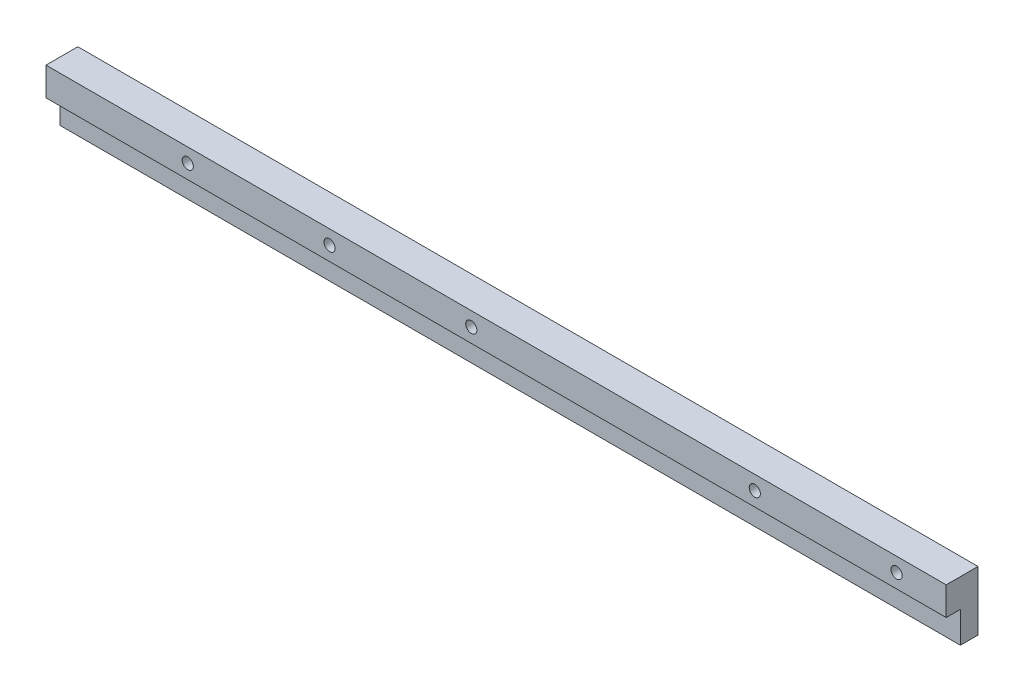
from build123d import *
from build123d.topology import SkipClean

# Parameters (mm, degrees)
BOSS_EXTRUDE1_DEPTH     = 177.8
SKETCH2_R               = 6.35
BOSS_EXTRUDE2_DEPTH     = 3.175
CUT_EXTRUDE1_DEPTH      = 7.62
SKETCH4_R               = 35.56
CUT_EXTRUDE2_DEPTH      = 5.08
BOSS_EXTRUDE3_DEPTH     = 3.175
BOSS_EXTRUDE4_START     = -3.175
BOSS_EXTRUDE4_DEPTH     = 3.175
SKETCH2_3_R             = 6.35
CUT_EXTRUDE3_DEPTH      = 203.2
SKETCH7_W               = 104.303861479
SKETCH7_H               = 17.78
CUT_EXTRUDE4_DEPTH      = 7.62
SKETCH9_W               = 5.09491902
SKETCH9_H               = 10.16
BOSS_EXTRUDE5_DEPTH     = 373.38
SKETCH10_W              = 16.389929124
SKETCH10_H              = 55.852942909
CUT_EXTRUDE5_DEPTH      = 50.8
SKETCH11_W              = 37.311204657
SKETCH11_H              = 70.036499624
CUT_EXTRUDE6_DEPTH      = 63.5
CUT_EXTRUDE_THIN3_DEPTH = 1.27
BOSS_EXTRUDE6_DEPTH     = 1.27
BOSS_EXTRUDE6_2_DEPTH   = 1.27
BOSS_EXTRUDE6_3_DEPTH   = 1.27
BOSS_EXTRUDE6_4_DEPTH   = 1.27
SKETCH14_R              = 6.35
CUT_EXTRUDE7_DEPTH      = 6.35
SKETCH15_R              = 6.35
CUT_EXTRUDE8_DEPTH      = 6.35
SKETCH16_R              = 2
CUT_EXTRUDE9_DEPTH      = 203.2
SKETCH17_R              = 2
CUT_EXTRUDE10_DEPTH     = 50.8
CUT_EXTRUDE11_DEPTH     = 50.8
CUT_EXTRUDE12_DEPTH     = 135.636
SKETCH20_W              = 88.9
SKETCH20_H              = 19.05
CUT_EXTRUDE13_DEPTH     = 25.4
SKETCH22_W              = 88.9
SKETCH22_H              = 19.05
CUT_EXTRUDE14_DEPTH     = 25.4
CUT_EXTRUDE15_DEPTH     = 12.7
SKETCH24_R              = 1.5
CUT_EXTRUDE16_DEPTH     = 12.7
SKETCH25_W              = 227.828611999
SKETCH25_H              = 364.913546761
CUT_EXTRUDE17_DEPTH     = 381


with BuildPart() as part:
    # Sketch1 → Boss-Extrude1 (new body)
    with BuildSketch(Plane.XY):
        Polygon((174.206706958, 205.225588808), (176.700980282, 203.057350086), (6.59291173, 7.37040221), (4.098638405, 9.538640932), align=None)
        Polygon((176.700980282, 203.057350086), (176.700980282, 207.584488047), (174.206706958, 205.225588808), align=None)
        Polygon((176.700980282, 203.057350086), (176.700980282, 207.584488047), (294.86623267, 79.97762329), (292.609334988, 77.887713122), align=None)
        Polygon((176.700980282, 203.057350086), (6.59291173, 7.37040221), (11.706315855, 7.37040221), (176.700980282, 197.43083223), align=None)
        Polygon((292.609334988, 77.887713122), (179.222024463, 200.334870023), (176.700980282, 197.43083223), (289.802992908, 75.306026972), align=None)
        Polygon((179.222024463, 200.334870023), (176.700980282, 203.057350086), (176.700980282, 197.43083223), align=None)
    extrude(amount=BOSS_EXTRUDE1_DEPTH)

    # Sketch2 → Boss-Extrude2 (add)
    with BuildSketch(Plane(origin=(0, 0, 0), x_dir=(-1, 0, 0), z_dir=(0, 0, -1))):
        Polygon((-176.700980282, 207.584488047), (-294.86623267, 79.97762329), (-294.86623267, 308.57762329), (-4.03623267, 308.57762329), (-4.03623267, 9.466851346), align=None)
        with Locations((-109.551832016, 215.6073789)):
            Circle(SKETCH2_R, mode=Mode.SUBTRACT)
        with Locations((-50.099162461, 143.63835786)):
            Circle(SKETCH2_R, mode=Mode.SUBTRACT)
    boss_extrude2 = extrude(amount=-BOSS_EXTRUDE2_DEPTH)

    # Mirror1: Boss-Extrude2 across plane
    add(boss_extrude2.mirror(Plane.XY.offset(88.9)))

    # Sketch3 → Cut-Extrude1 (cut)
    with BuildSketch(Plane(origin=(-2.388376456, 2.076183978, 0), x_dir=(0.6560590289905027, 0.754709580222776, 0), z_dir=(-0.754709580222776, 0.6560590289905027, 0))):
        Polygon((146.938003774, -3.175), (147.021985505, -88.9), (210.43489334, -88.9), (210.43489334, -3.175), align=None)
        Polygon((210.43489334, -88.9), (147.021985505, -88.9), (147.047852426, -115.303859178), (210.43489334, -115.303859178), align=None)
    extrude(amount=-CUT_EXTRUDE1_DEPTH, mode=Mode.SUBTRACT)

    # Sketch4 → Cut-Extrude2 (cut)
    with BuildSketch(Plane.XY.offset(3.175)):
        with Locations((115.138547862, 136.94700246)):
            Circle(SKETCH4_R)
    extrude(amount=-CUT_EXTRUDE2_DEPTH, mode=Mode.SUBTRACT)

    # Sketch5 → Boss-Extrude3 (add)
    with BuildSketch(Plane(origin=(0, 0, 0), x_dir=(-1, 0, 0), z_dir=(0, 0, -1))):
        with BuildLine():
            Line((23.718677813, 87.809342908), (-4.03623267, 87.809342908))
            Line((-4.03623267, 87.809342908), (-4.03623267, 68.97229904))
            ThreePointArc((-4.03623267, 68.97229904), (2.710389506, 69.812621892), (6.35, 64.070123417))
            ThreePointArc((6.35, 64.070123417), (2.710389506, 58.327624943), (-4.03623267, 59.167947795))
            Line((-4.03623267, 59.167947795), (-4.03623267, 41.258157594))
            Line((-4.03623267, 41.258157594), (23.718677813, 41.258157594))
            Line((23.718677813, 41.258157594), (23.718677813, 87.809342908))
        make_face()
    extrude(amount=-BOSS_EXTRUDE3_DEPTH)

    # Sketch6 → Boss-Extrude4 (add)
    with BuildSketch(Plane.XY.offset(177.8).offset(BOSS_EXTRUDE4_START)):
        with BuildLine():
            Line((4.03623267, 68.97229904), (4.03623267, 87.809342908))
            Line((4.03623267, 87.809342908), (-23.718677813, 87.809342908))
            Line((-23.718677813, 87.809342908), (-23.718677813, 41.258157594))
            Line((-23.718677813, 41.258157594), (4.03623267, 41.258157594))
            Line((4.03623267, 41.258157594), (4.03623267, 59.167947795))
            ThreePointArc((4.03623267, 59.167947795), (-6.35, 64.070123417), (4.03623267, 68.97229904))
        make_face()
    extrude(amount=BOSS_EXTRUDE4_DEPTH)

    # Sketch2<3> → Cut-Extrude3 (cut)
    with SkipClean():  # the faces are left unmerged after this step: merging them gives an invalid solid
        with BuildSketch(Plane(origin=(0, 0, 0), x_dir=(-1, 0, 0), z_dir=(0, 0, -1))):
            with Locations((0, 64.070123417)):
                Circle(SKETCH2_3_R)
        extrude(amount=-CUT_EXTRUDE3_DEPTH, mode=Mode.SUBTRACT)

    # Sketch7 → Cut-Extrude4 (cut)
    with SkipClean():  # the faces are left unmerged after this step: merging them gives an invalid solid
        with BuildSketch(Plane(origin=(198.614996443, 183.919503291, 0), x_dir=(0, 0, -1), z_dir=(0.7337298645028701, 0.6794413042615234, 0))):
            with Locations((-88.799310538, -132.772327008)):
                Rectangle(SKETCH7_W, SKETCH7_H)
        extrude(amount=-CUT_EXTRUDE4_DEPTH, mode=Mode.SUBTRACT)

    # Sketch9 → Boss-Extrude5 (add)
    with SkipClean():  # the faces are left unmerged after this step: merging them gives an invalid solid
        with BuildSketch(Plane(origin=(294.86623267, 0, 0), x_dir=(0, 0, -1), z_dir=(1, 0, 0))):
            with Locations((2.54745951, 191.791667894)):
                Rectangle(SKETCH9_W, SKETCH9_H)
            Polygon((5.09491902, 196.871667894), (5.09491902, 186.711667894), (5.09491902, 175.560674011), (11.405822058, 175.560674011), (11.405822058, 196.871667894), align=None)
        boss_extrude5 = extrude(amount=-BOSS_EXTRUDE5_DEPTH)

    # Mirror2: Boss-Extrude5 across plane
    with SkipClean():  # the faces are left unmerged after this step: merging them gives an invalid solid
        add(boss_extrude5.mirror(Plane.XY.offset(88.9)))

    # Sketch10 → Cut-Extrude5 (cut)
    with SkipClean():  # the faces are left unmerged after this step: merging them gives an invalid solid
        with BuildSketch(Plane(origin=(294.86623267, 0, 0), x_dir=(0, 0, -1), z_dir=(1, 0, 0))):
            with Locations((8.194964562, 177.809205996)):
                Rectangle(SKETCH10_W, SKETCH10_H)
        extrude(amount=-CUT_EXTRUDE5_DEPTH, mode=Mode.SUBTRACT)

    # Sketch11 → Cut-Extrude6 (cut)
    with SkipClean():  # the faces are left unmerged after this step: merging them gives an invalid solid
        with BuildSketch(Plane(origin=(0, 0, 0), x_dir=(-1, 0, 0), z_dir=(0, 0, -1))):
            with Locations((-276.210630342, 174.143668429)):
                Rectangle(SKETCH11_W, SKETCH11_H)
        extrude(amount=-CUT_EXTRUDE6_DEPTH, mode=Mode.SUBTRACT)

    # Sketch12 → Cut-Extrude-Thin3 (cut)
    with SkipClean():  # the faces are left unmerged after this step: merging them gives an invalid solid
        with BuildSketch(Plane(origin=(198.614996443, 183.919503291, 0), x_dir=(0, 0, -1), z_dir=(0.7337298645028701, 0.6794413042615234, 0))):
            Polygon((-171.532951818, 28.022585612), (-143.20199229, -115.162103868), (-139.962790584, -114.521185535), (-168.293750113, 28.663503944), align=None)
            Polygon((-33.454545449, -115.162103868), (-6.228065693, 28.022585612), (-9.471942339, 28.639406741), (-36.698422095, -114.545282739), align=None)
        extrude(amount=-CUT_EXTRUDE_THIN3_DEPTH, mode=Mode.SUBTRACT)

    # Sketch14 → Cut-Extrude7 (cut)
    with SkipClean():  # the faces are left unmerged after this step: merging them gives an invalid solid
        with BuildSketch(Plane.XY.offset(3.175)):
            with Locations((25.62623267, 167.726388192)):
                Circle(SKETCH14_R)
        extrude(amount=-CUT_EXTRUDE7_DEPTH, mode=Mode.SUBTRACT)

    # Sketch15 → Cut-Extrude8 (cut)
    with SkipClean():  # the faces are left unmerged after this step: merging them gives an invalid solid
        with BuildSketch(Plane.XY.offset(177.8)):
            with Locations((25.62623267, 167.726388192)):
                Circle(SKETCH15_R)
        extrude(amount=-CUT_EXTRUDE8_DEPTH, mode=Mode.SUBTRACT)

    # Sketch16 → Cut-Extrude9 (cut)
    with SkipClean():  # the faces are left unmerged after this step: merging them gives an invalid solid
        with BuildSketch(Plane(origin=(0, 0, -11.405822058), x_dir=(-1, 0, 0), z_dir=(0, 0, -1))):
            with Locations(Location((-226.28623267, 191.791667894, 0), (0, 0, 180))):
                Circle(SKETCH16_R)
            with Locations(Location((-175.48623267, 191.791667894, 0), (0, 0, 90))):
                Circle(SKETCH16_R)
            with Locations(Location((-73.88623267, 191.791667894, 0), (0, 0, 180))):
                Circle(SKETCH16_R)
            with Locations(Location((-23.08623267, 191.791667894, 0), (0, 0, 180))):
                Circle(SKETCH16_R)
            with Locations(Location((27.71376733, 191.791667894, 0), (0, 0, 90))):
                Circle(SKETCH16_R)
        extrude(amount=-CUT_EXTRUDE9_DEPTH, mode=Mode.SUBTRACT)

    # Sketch17 → Cut-Extrude10 (cut)
    with SkipClean():  # the faces are left unmerged after this step: merging them gives an invalid solid
        with BuildSketch(Plane.XY.offset(189.205822058)):
            with Locations((272.00623267, 191.73762329)):
                Circle(SKETCH17_R)
        extrude(amount=-CUT_EXTRUDE10_DEPTH, mode=Mode.SUBTRACT)

    # Sketch18 → Cut-Extrude11 (cut)
    with SkipClean():  # the faces are left unmerged after this step: merging them gives an invalid solid
        with BuildSketch(Plane(origin=(198.614996443, 183.919503291, 0), x_dir=(0, 0, -1), z_dir=(0.7337298645028701, 0.6794413042615234, 0))):
            Polygon((-170.82495725, -33.509501551), (-170.82495725, -115.912858784), (-148.021512482, -115.912858784), (-165.124096058, -33.509501551), align=None)
        extrude(amount=-CUT_EXTRUDE11_DEPTH, mode=Mode.SUBTRACT)

    # Sketch19 → Cut-Extrude12 (cut)
    with SkipClean():  # the faces are left unmerged after this step: merging them gives an invalid solid
        with BuildSketch(Plane(origin=(198.614996443, 183.919503291, 0), x_dir=(0, 0, -1), z_dir=(0.7337298645028701, 0.6794413042615234, 0))):
            Polygon((-27.790980507, -115.912858784), (-12.83560064, -35.35545082), (-7.206169917, -35.35545082), (-7.206169917, -115.912858784), align=None)
        extrude(amount=-CUT_EXTRUDE12_DEPTH, mode=Mode.SUBTRACT)

    # Sketch20 → Cut-Extrude13 (cut)
    with SkipClean():  # the faces are left unmerged after this step: merging them gives an invalid solid
        with BuildSketch(Plane.XY.offset(177.8)):
            with BuildLine():
                Line((162.857920191, 291.02562329), (162.857920191, 292.57562329))
                Line((162.857920191, 292.57562329), (164.407920191, 292.57562329))
                ThreePointArc((164.407920191, 292.57562329), (161.76190468, 293.671638801), (162.857920191, 291.02562329))
            make_face()
            with BuildLine():
                Line((164.407920191, 292.57562329), (162.857920191, 292.57562329))
                Line((162.857920191, 292.57562329), (162.857920191, 291.02562329))
                ThreePointArc((162.857920191, 291.02562329), (163.953935702, 291.479607779), (164.407920191, 292.57562329))
            make_face()
            with BuildLine():
                ThreePointArc((266.007920191, 292.57562329), (264.457920191, 294.12562329), (262.907920191, 292.57562329))
                Line((262.907920191, 292.57562329), (264.457920191, 292.57562329))
                Line((264.457920191, 292.57562329), (264.457920191, 291.02562329))
                ThreePointArc((264.457920191, 291.02562329), (265.553935702, 291.479607779), (266.007920191, 292.57562329))
            make_face()
            with BuildLine():
                Line((264.457920191, 292.57562329), (262.907920191, 292.57562329))
                ThreePointArc((262.907920191, 292.57562329), (263.36190468, 291.479607779), (264.457920191, 291.02562329))
                Line((264.457920191, 291.02562329), (264.457920191, 292.57562329))
            make_face()
            with BuildLine():
                ThreePointArc((164.407920191, 241.77562329), (163.953935702, 242.871638801), (162.857920191, 243.32562329))
                Line((162.857920191, 243.32562329), (162.857920191, 241.77562329))
                Line((162.857920191, 241.77562329), (164.407920191, 241.77562329))
            make_face()
            with BuildLine():
                Line((162.857920191, 241.77562329), (162.857920191, 243.32562329))
                ThreePointArc((162.857920191, 243.32562329), (161.76190468, 240.679607779), (164.407920191, 241.77562329))
                Line((164.407920191, 241.77562329), (162.857920191, 241.77562329))
            make_face()
            with BuildLine():
                ThreePointArc((266.007920191, 241.77562329), (265.553935702, 242.871638801), (264.457920191, 243.32562329))
                Line((264.457920191, 243.32562329), (264.457920191, 241.77562329))
                Line((264.457920191, 241.77562329), (262.907920191, 241.77562329))
                ThreePointArc((262.907920191, 241.77562329), (264.457920191, 240.22562329), (266.007920191, 241.77562329))
            make_face()
            with BuildLine():
                Line((264.457920191, 241.77562329), (264.457920191, 243.32562329))
                ThreePointArc((264.457920191, 243.32562329), (263.36190468, 242.871638801), (262.907920191, 241.77562329))
                Line((262.907920191, 241.77562329), (264.457920191, 241.77562329))
            make_face()
            with Locations((213.657920191, 282.969686208)):
                Rectangle(SKETCH20_W, SKETCH20_H)
        extrude(amount=-CUT_EXTRUDE13_DEPTH, mode=Mode.SUBTRACT)

    # Sketch22 → Cut-Extrude14 (cut)
    with SkipClean():  # the faces are left unmerged after this step: merging them gives an invalid solid
        with BuildSketch(Plane(origin=(0, 0, 0), x_dir=(-1, 0, 0), z_dir=(0, 0, -1))):
            with BuildLine():
                Line((-264.581570713, 291.02562329), (-264.581570713, 292.57562329))
                Line((-264.581570713, 292.57562329), (-263.031570713, 292.57562329))
                ThreePointArc((-263.031570713, 292.57562329), (-265.677586224, 293.671638801), (-264.581570713, 291.02562329))
            make_face()
            with BuildLine():
                Line((-263.031570713, 292.57562329), (-264.581570713, 292.57562329))
                Line((-264.581570713, 292.57562329), (-264.581570713, 291.02562329))
                ThreePointArc((-264.581570713, 291.02562329), (-263.485555202, 291.479607779), (-263.031570713, 292.57562329))
            make_face()
            with BuildLine():
                ThreePointArc((-263.031570713, 241.77562329), (-263.485555202, 242.871638801), (-264.581570713, 243.32562329))
                Line((-264.581570713, 243.32562329), (-264.581570713, 241.77562329))
                Line((-264.581570713, 241.77562329), (-263.031570713, 241.77562329))
            make_face()
            with BuildLine():
                Line((-264.581570713, 241.77562329), (-264.581570713, 243.32562329))
                ThreePointArc((-264.581570713, 243.32562329), (-265.677586224, 240.679607779), (-263.031570713, 241.77562329))
                Line((-263.031570713, 241.77562329), (-264.581570713, 241.77562329))
            make_face()
            with BuildLine():
                ThreePointArc((-161.431570713, 292.57562329), (-162.981570713, 294.12562329), (-164.531570713, 292.57562329))
                Line((-164.531570713, 292.57562329), (-162.981570713, 292.57562329))
                Line((-162.981570713, 292.57562329), (-162.981570713, 291.02562329))
                ThreePointArc((-162.981570713, 291.02562329), (-161.885555202, 291.479607779), (-161.431570713, 292.57562329))
            make_face()
            with BuildLine():
                Line((-162.981570713, 292.57562329), (-164.531570713, 292.57562329))
                ThreePointArc((-164.531570713, 292.57562329), (-164.077586224, 291.479607779), (-162.981570713, 291.02562329))
                Line((-162.981570713, 291.02562329), (-162.981570713, 292.57562329))
            make_face()
            with BuildLine():
                ThreePointArc((-161.431570713, 241.77562329), (-161.885555202, 242.871638801), (-162.981570713, 243.32562329))
                Line((-162.981570713, 243.32562329), (-162.981570713, 241.77562329))
                Line((-162.981570713, 241.77562329), (-164.531570713, 241.77562329))
                ThreePointArc((-164.531570713, 241.77562329), (-162.981570713, 240.22562329), (-161.431570713, 241.77562329))
            make_face()
            with BuildLine():
                Line((-162.981570713, 241.77562329), (-162.981570713, 243.32562329))
                ThreePointArc((-162.981570713, 243.32562329), (-164.077586224, 242.871638801), (-164.531570713, 241.77562329))
                Line((-164.531570713, 241.77562329), (-162.981570713, 241.77562329))
            make_face()
            with Locations((-213.781570713, 283.028383525)):
                Rectangle(SKETCH22_W, SKETCH22_H)
        extrude(amount=-CUT_EXTRUDE14_DEPTH, mode=Mode.SUBTRACT)

    # Sketch23 → Cut-Extrude15 (cut)
    with SkipClean():  # the faces are left unmerged after this step: merging them gives an invalid solid
        with BuildSketch(Plane(origin=(0, 0, 0), x_dir=(-1, 0, 0), z_dir=(0, 0, -1))):
            with BuildLine():
                ThreePointArc((-281.46966057, 89.27791623), (-283.589396682, 89.195947845), (-283.507428297, 87.076211733))
                Line((-283.507428297, 87.076211733), (-281.46966057, 89.27791623))
            make_face()
            with BuildLine():
                Line((-281.46966057, 89.27791623), (-283.507428297, 87.076211733))
                ThreePointArc((-283.507428297, 87.076211733), (-281.887847254, 86.802595758), (-280.988544434, 88.177063981))
                ThreePointArc((-280.988544434, 88.177063981), (-281.11407621, 88.777761162), (-281.46966057, 89.27791623))
            make_face()
            with BuildLine():
                ThreePointArc((-261.677113571, 110.662757672), (-263.796849683, 110.580789287), (-263.714881298, 108.461053175))
                Line((-263.714881298, 108.461053175), (-261.677113571, 110.662757672))
            make_face()
            with BuildLine():
                Line((-261.677113571, 110.662757672), (-263.714881298, 108.461053175))
                ThreePointArc((-263.714881298, 108.461053175), (-262.095300254, 108.1874372), (-261.195997434, 109.561905424))
                ThreePointArc((-261.195997434, 109.561905424), (-261.321529211, 110.162602604), (-261.677113571, 110.662757672))
            make_face()
            with BuildLine():
                ThreePointArc((-242.471013434, 131.413973074), (-244.590749546, 131.332004689), (-244.508781161, 129.212268577))
                Line((-244.508781161, 129.212268577), (-242.471013434, 131.413973074))
            make_face()
            with BuildLine():
                Line((-242.471013434, 131.413973074), (-244.508781161, 129.212268577))
                ThreePointArc((-244.508781161, 129.212268577), (-242.889200117, 128.938652602), (-241.989897298, 130.313120826))
                ThreePointArc((-241.989897298, 130.313120826), (-242.115429074, 130.913818006), (-242.471013434, 131.413973074))
            make_face()
            with BuildLine():
                ThreePointArc((-221.219107983, 154.375577179), (-223.338844094, 154.293608794), (-223.256875709, 152.173872682))
                Line((-223.256875709, 152.173872682), (-221.219107983, 154.375577179))
            make_face()
            with BuildLine():
                Line((-221.219107983, 154.375577179), (-223.256875709, 152.173872682))
                ThreePointArc((-223.256875709, 152.173872682), (-221.637294666, 151.900256707), (-220.737991846, 153.274724931))
                ThreePointArc((-220.737991846, 153.274724931), (-220.863523622, 153.875422111), (-221.219107983, 154.375577179))
            make_face()
            with BuildLine():
                ThreePointArc((-145.886078234, 168.131923716), (-146.764955289, 169.497283115), (-148.371686616, 169.262665118))
                Line((-148.371686616, 169.262665118), (-146.400469852, 167.001182315))
                ThreePointArc((-146.400469852, 167.001182315), (-146.020718836, 167.510800771), (-145.886078234, 168.131923716))
            make_face()
            with BuildLine():
                Line((-146.400469852, 167.001182315), (-148.371686616, 169.262665118))
                ThreePointArc((-148.371686616, 169.262665118), (-148.516819636, 167.146315334), (-146.400469852, 167.001182315))
            make_face()
            with BuildLine():
                ThreePointArc((-49.387047149, 57.423196347), (-50.265924204, 58.788555745), (-51.872655531, 58.553937749))
                Line((-51.872655531, 58.553937749), (-49.901438767, 56.292454945))
                ThreePointArc((-49.901438767, 56.292454945), (-49.521687751, 56.802073401), (-49.387047149, 57.423196347))
            make_face()
            with BuildLine():
                Line((-49.901438767, 56.292454945), (-51.872655531, 58.553937749))
                ThreePointArc((-51.872655531, 58.553937749), (-52.017788551, 56.437587965), (-49.901438767, 56.292454945))
            make_face()
            with BuildLine():
                ThreePointArc((-31.668427664, 37.095470857), (-32.547304719, 38.460830256), (-34.154036046, 38.226212259))
                Line((-34.154036046, 38.226212259), (-32.182819282, 35.964729456))
                ThreePointArc((-32.182819282, 35.964729456), (-31.803068266, 36.474347912), (-31.668427664, 37.095470857))
            make_face()
            with BuildLine():
                Line((-32.182819282, 35.964729456), (-34.154036046, 38.226212259))
                ThreePointArc((-34.154036046, 38.226212259), (-34.299169066, 36.109862475), (-32.182819282, 35.964729456))
            make_face()
            with BuildLine():
                ThreePointArc((-16.066850555, 19.196526928), (-16.94572761, 20.561886326), (-18.552458937, 20.327268329))
                Line((-18.552458937, 20.327268329), (-16.581242173, 18.065785526))
                ThreePointArc((-16.581242173, 18.065785526), (-16.201491157, 18.575403982), (-16.066850555, 19.196526928))
            make_face()
            with BuildLine():
                Line((-16.581242173, 18.065785526), (-18.552458937, 20.327268329))
                ThreePointArc((-18.552458937, 20.327268329), (-18.697591957, 18.210918546), (-16.581242173, 18.065785526))
            make_face()
        extrude(amount=-CUT_EXTRUDE15_DEPTH, mode=Mode.SUBTRACT)

    # Sketch24 → Cut-Extrude16 (cut)
    with SkipClean():  # the faces are left unmerged after this step: merging them gives an invalid solid
        with BuildSketch(Plane.XY.offset(177.8)):
            with Locations((277.221839581, 93.68533948)):
                Circle(SKETCH24_R)
            with Locations((256.088046252, 116.620130178)):
                Circle(SKETCH24_R)
            with Locations((233.352788284, 141.292860476)):
                Circle(SKETCH24_R)
            with Locations((211.758500856, 164.727388047)):
                Circle(SKETCH24_R)
            with Locations((135.020648746, 154.397680008)):
                Circle(SKETCH24_R)
            with Locations((113.672052573, 129.804959434)):
                Circle(SKETCH24_R)
            with Locations((89.546525068, 102.013326118)):
                Circle(SKETCH24_R)
            with Locations((62.67652141, 71.060167118)):
                Circle(SKETCH24_R)
            with Locations((39.522371339, 44.387521375)):
                Circle(SKETCH24_R)
        extrude(amount=-CUT_EXTRUDE16_DEPTH, mode=Mode.SUBTRACT)


with BuildPart() as body_2:
    # Sketch13 → Boss-Extrude6 (new body)
    with BuildSketch(Plane(origin=(198.614996443, 183.919503291, 0), x_dir=(0, 0, -1), z_dir=(0.7337298645028701, 0.6794413042615234, 0))):
        Polygon((-171.532951818, 28.022585612), (-171.375187306, 27.225243654), (-168.293750113, 28.663503944), align=None)
    extrude(amount=-BOSS_EXTRUDE6_DEPTH)


with BuildPart() as body_3:
    # Sketch13 → Boss-Extrude6 2 (new body)
    with BuildSketch(Plane(origin=(198.614996443, 183.919503291, 0), x_dir=(0, 0, -1), z_dir=(0.7337298645028701, 0.6794413042615234, 0))):
        Polygon((-143.20199229, -115.162103868), (-140.120555097, -113.723843577), (-139.962790584, -114.521185535), align=None)
    extrude(amount=-BOSS_EXTRUDE6_2_DEPTH)


with BuildPart() as body_4:
    # Sketch13 → Boss-Extrude6 3 (new body)
    with BuildSketch(Plane(origin=(198.614996443, 183.919503291, 0), x_dir=(0, 0, -1), z_dir=(0.7337298645028701, 0.6794413042615234, 0))):
        Polygon((-9.471942339, 28.639406741), (-6.382619108, 27.209785612), (-6.228065693, 28.022585612), align=None)
    extrude(amount=-BOSS_EXTRUDE6_3_DEPTH)


with BuildPart() as body_5:
    # Sketch13 → Boss-Extrude6 4 (new body)
    with BuildSketch(Plane(origin=(198.614996443, 183.919503291, 0), x_dir=(0, 0, -1), z_dir=(0.7337298645028701, 0.6794413042615234, 0))):
        Polygon((-36.698422095, -114.545282739), (-33.302712556, -114.363611155), (-33.454545449, -115.162103868), align=None)
    extrude(amount=-BOSS_EXTRUDE6_4_DEPTH)


with BuildPart() as cut_extrude17_tool:
    # Sketch25 → Cut-Extrude17 (new body)
    with BuildSketch(Plane(origin=(294.86623267, 0, 0), x_dir=(0, 0, -1), z_dir=(1, 0, 0))):
        with Locations((-113.914306, 126.12084991)):
            Rectangle(SKETCH25_W, SKETCH25_H)
    extrude(amount=-CUT_EXTRUDE17_DEPTH)


with BuildPart() as part_1:
    add(part.part)

    # Cut-Extrude17: cut by cut_extrude17_tool
    add(cut_extrude17_tool.part, mode=Mode.SUBTRACT)


with BuildPart() as body_2_1:
    add(body_2.part)

    # Cut-Extrude17: cut by cut_extrude17_tool
    add(cut_extrude17_tool.part, mode=Mode.SUBTRACT)


with BuildPart() as body_3_1:
    add(body_3.part)

    # Cut-Extrude17: cut by cut_extrude17_tool
    add(cut_extrude17_tool.part, mode=Mode.SUBTRACT)


with BuildPart() as body_4_1:
    add(body_4.part)

    # Cut-Extrude17: cut by cut_extrude17_tool
    add(cut_extrude17_tool.part, mode=Mode.SUBTRACT)


with BuildPart() as body_5_1:
    add(body_5.part)

    # Cut-Extrude17: cut by cut_extrude17_tool
    add(cut_extrude17_tool.part, mode=Mode.SUBTRACT)


solid = part_1.part
